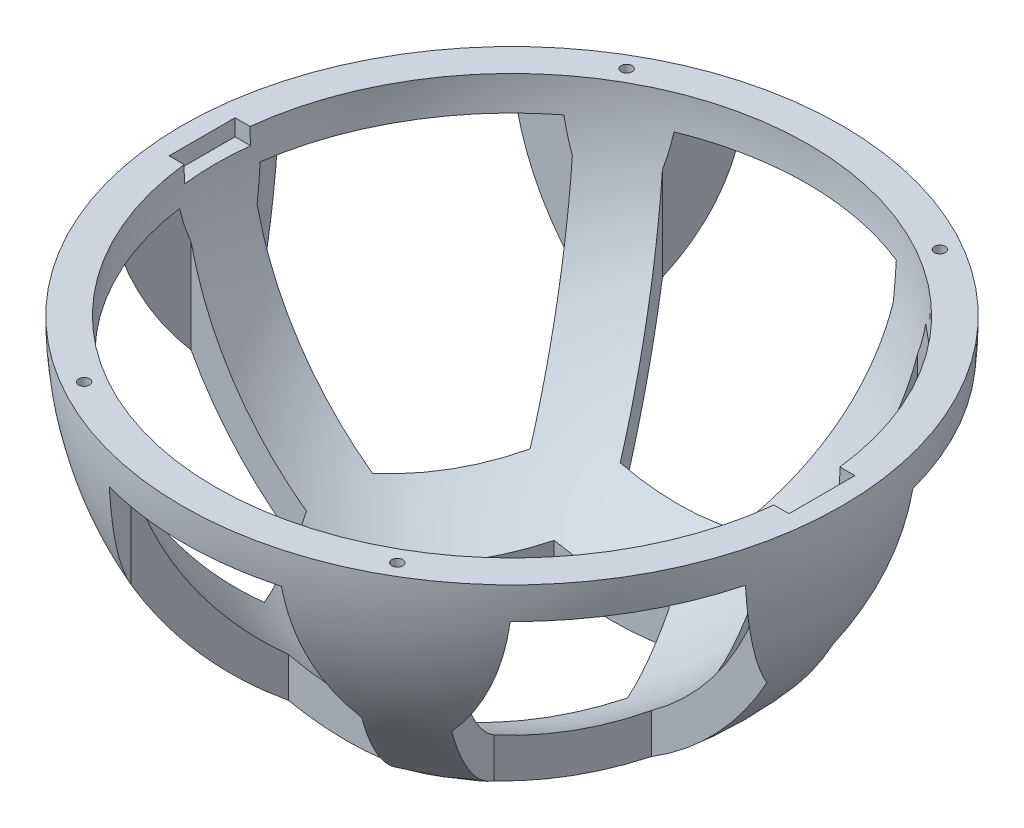
from build123d import *

# Parameters (mm, degrees)
REVOLUCI_N_L_MINA1_ANGLE      = 180
CORTAR_EXTRUIR1_START         = -10
CORTAR_EXTRUIR1_DEPTH         = 100
CORTAR_EXTRUIR2_DEPTH         = 184
CORTAR_EXTRUIR2_DEPTH_BACK    = 4
CROQUIS4_W                    = 20
CROQUIS4_H                    = 10
TALADRO_ROSCADO_M4X0_71_D     = 3.3
TALADRO_ROSCADO_M4X0_71_DEPTH = 12
TALADRO_ROSCADO_M4X0_71_TIP   = 0.991420021


with BuildPart() as part:
    # Croquis1 → Revolución-Lámina1 (revolve)
    with BuildSketch(Plane(origin=(0, 0, 0), x_dir=(1, 0, 0), z_dir=(0, 1, 0))):
        with BuildLine():
            ThreePointArc((0, 100), (100, 0), (0, -100))
            Line((0, -100), (0, -90))
            ThreePointArc((0, -90), (90, 0), (0, 90))
            Line((0, 90), (0, 100))
        make_face()
    revolve(axis=Axis((0, 0, -100), (0, 0, -1)), revolution_arc=REVOLUCI_N_L_MINA1_ANGLE)

    # Croquis2 → Cortar-Extruir1 (cut)
    with BuildSketch(Plane(origin=(0, 0, 0), x_dir=(1, 0, 0), z_dir=(0, 1, 0)).offset(CORTAR_EXTRUIR1_START)):
        Polygon((17.5, 30.310889132), (-17.5, 30.310889132), (-35, 0), (-17.5, -30.310889132), (17.5, -30.310889132), (35, 0), align=None)
        Polygon((104.820508076, 40.310889132), (87.320508076, 70.621778265), (52.320508076, 70.621778265), (34.820508076, 40.310889132), (52.320508076, 10), (87.320508076, 10), align=None)
        Polygon((17.5, 110.932667397), (-17.5, 110.932667397), (-35, 80.621778265), (-17.5, 50.310889132), (17.5, 50.310889132), (35, 80.621778265), align=None)
        Polygon((87.320508076, -70.621778265), (104.820508076, -40.310889132), (87.320508076, -10), (52.320508076, -10), (34.820508076, -40.310889132), (52.320508076, -70.621778265), align=None)
        Polygon((-17.5, -110.932667397), (17.5, -110.932667397), (35, -80.621778265), (17.5, -50.310889132), (-17.5, -50.310889132), (-35, -80.621778265), align=None)
        Polygon((-104.820508076, -40.310889132), (-87.320508076, -70.621778265), (-52.320508076, -70.621778265), (-34.820508076, -40.310889132), (-52.320508076, -10), (-87.320508076, -10), align=None)
        Polygon((-87.320508076, 70.621778265), (-104.820508076, 40.310889132), (-87.320508076, 10), (-52.320508076, 10), (-34.820508076, 40.310889132), (-52.320508076, 70.621778265), align=None)
    extrude(amount=-CORTAR_EXTRUIR1_DEPTH, mode=Mode.SUBTRACT)

    # Croquis4 → Cortar-Extruir2 (cut, two sides: drawn at the far end of the back side and taken through both)
    with BuildSketch(Plane.ZY.offset(-90).offset(-CORTAR_EXTRUIR2_DEPTH_BACK)):
        Rectangle(CROQUIS4_W, CROQUIS4_H)
    extrude(amount=CORTAR_EXTRUIR2_DEPTH + CORTAR_EXTRUIR2_DEPTH_BACK, mode=Mode.SUBTRACT)

    # Taladro roscado M4x0.71
    with Locations(Plane(origin=(0, 0, 0), x_dir=(1, 0, 0), z_dir=(0, 1, 0))):
        with Locations((-47.5, -82.27241336), (47.5, 82.27241336), (47.5, -82.27241336), (-47.5, 82.27241336)):
            Hole(TALADRO_ROSCADO_M4X0_71_D / 2, depth=TALADRO_ROSCADO_M4X0_71_DEPTH)
            with Locations((0, 0, -(TALADRO_ROSCADO_M4X0_71_DEPTH + TALADRO_ROSCADO_M4X0_71_TIP / 2))):  # 118° drill point
                Cone(0, TALADRO_ROSCADO_M4X0_71_D / 2, TALADRO_ROSCADO_M4X0_71_TIP, mode=Mode.SUBTRACT)


solid = part.part
